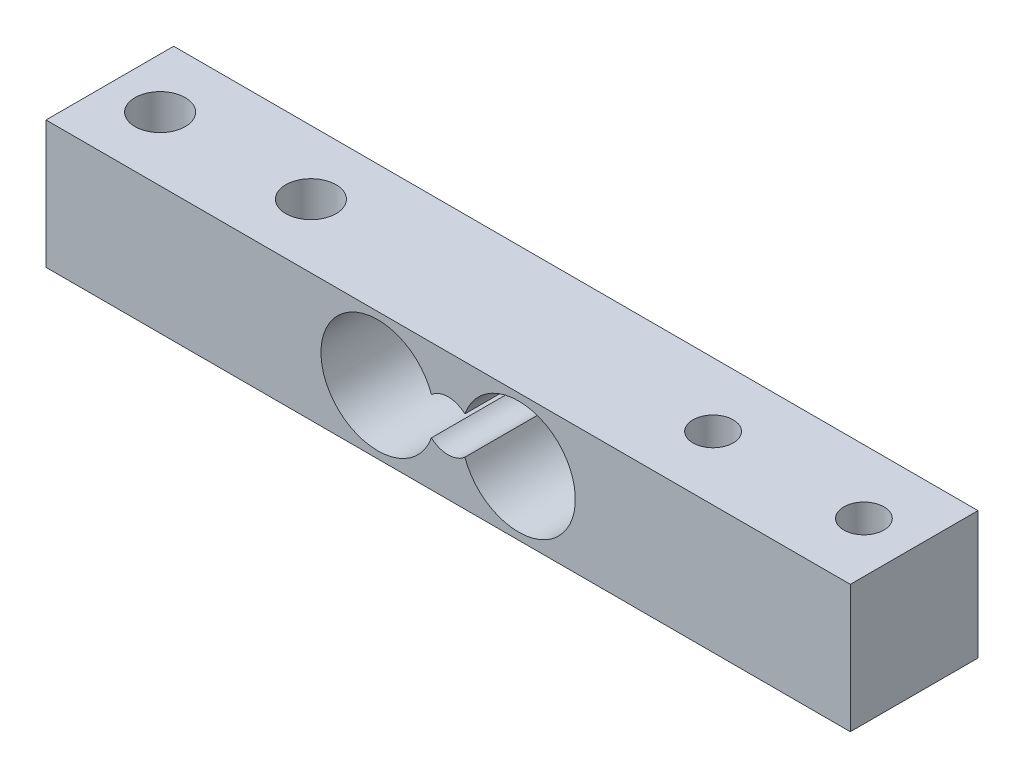
from build123d import *

# Parameters (mm, degrees)
SKETCH1_W           = 80
SKETCH1_H           = 12.7
SKETCH1_R           = 2.5
SKETCH1_R_2         = 2
BOSS_EXTRUDE1_DEPTH = 12.7
CUT_EXTRUDE1_DEPTH  = 44.847234804


with BuildPart() as part:
    # Sketch1 → Boss-Extrude1 (new body)
    with BuildSketch(Plane(origin=(0, 0, 0), x_dir=(1, 0, 0), z_dir=(0, 1, 0))):
        Rectangle(SKETCH1_W, SKETCH1_H)
        with Locations(Location((-35, 0, 0), (0, 0, 270))):
            Circle(SKETCH1_R, mode=Mode.SUBTRACT)
        with Locations(Location((-20, 0, 0), (0, 0, 270))):
            Circle(SKETCH1_R, mode=Mode.SUBTRACT)
        with Locations(Location((20, 0, 0), (0, 0, 270))):
            Circle(SKETCH1_R_2, mode=Mode.SUBTRACT)
        with Locations(Location((35, 0, 0), (0, 0, 270))):
            Circle(SKETCH1_R_2, mode=Mode.SUBTRACT)
    extrude(amount=BOSS_EXTRUDE1_DEPTH)

    # Sketch2 → Cut-Extrude1 (cut, through all)
    with BuildSketch(Plane.XY.offset(6.35)):
        with BuildLine():
            ThreePointArc((-1.66625, 8.213762575), (-12.65, 6.35), (-1.66625, 4.486237425))
            ThreePointArc((-1.66625, 4.486237425), (0, 3.85), (1.66625, 4.486237425))
            ThreePointArc((1.66625, 4.486237425), (12.65, 6.35), (1.66625, 8.213762575))
            ThreePointArc((1.66625, 8.213762575), (0, 8.85), (-1.66625, 8.213762575))
        make_face()
    extrude(amount=-CUT_EXTRUDE1_DEPTH, mode=Mode.SUBTRACT)


solid = part.part
